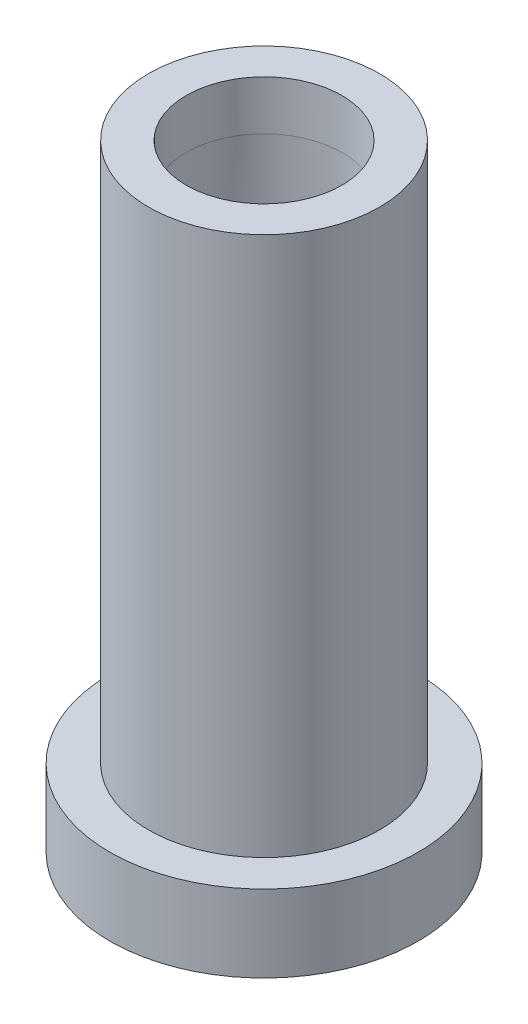
from build123d import *

# Parameters (mm, degrees)
CUT_EXTRUDE1_REACH = 44.426
SKETCH2_R          = 5.05


with BuildPart() as part:
    # Sketch1 → Revolve1 (revolve)
    with BuildSketch(Plane.XY, mode=Mode.PRIVATE) as revolve1_sk:
        Polygon((0, 0), (10, 0), (10, 5), (7.5, 5), (7.5, 40), (0, 40), align=None)
    revolve(revolve1_sk.sketch.rotate(Axis((0, 45, 0), (0, -1, 0)), 180), axis=Axis((0, 45, 0), (0, -1, 0)))

    # Sketch2 → Cut-Extrude1 (cut, up to next)
    with BuildSketch(Plane(origin=(0, 40, 0), x_dir=(1, 0, 0), z_dir=(0, 1, 0)), mode=Mode.PRIVATE) as cut_extrude1_sk1:
        with Locations(Location((0, 0, 0), (0, 0, 270))):
            Circle(SKETCH2_R)
    cut_extrude1_tool1 = extrude(cut_extrude1_sk1.sketch, amount=-CUT_EXTRUDE1_REACH, mode=Mode.PRIVATE) & part.part
    add(cut_extrude1_tool1.solids().sort_by_distance((0, 40, 0))[0], mode=Mode.SUBTRACT)

    # Cut-Sweep1: sweep along a curve in space
    with BuildLine() as cut_sweep1_path:
        ThreePointArc((0, 40, 5.05), (3.570889245, 40, 3.570889245), (5.05, 40, 0))
        ThreePointArc((5.05, 40, 0), (3.570889245, 40, -3.570889245), (0, 40, -5.05))
        ThreePointArc((0, 40, -5.05), (-3.570889245, 40, -3.570889245), (-5.05, 40, 0))
        ThreePointArc((-5.05, 40, 0), (-3.570889245, 40, 3.570889245), (0, 40, 5.05))
    # Sketch3 → Cut-Sweep1 (sweep, cut)
    with BuildSketch(Plane.XY):
        Polygon((5.05, 36.8), (6.013641914, 0), (5.05, 0), align=None)
    sweep(path=cut_sweep1_path.line, mode=Mode.SUBTRACT)


solid = part.part
